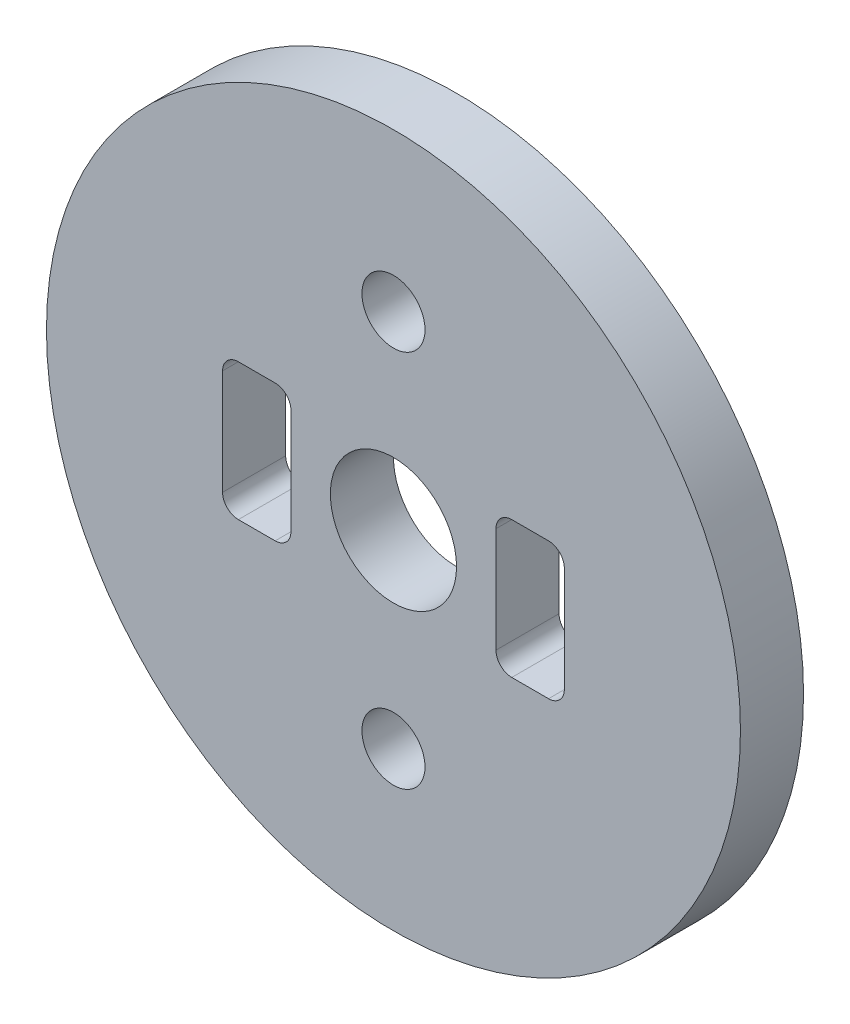
from build123d import *

# Parameters (mm, degrees)
MODEL_R                 = 16.5
MODEL_R_2               = 3
MODEL_R_3               = 1.5
SALIENTE_EXTRUIR1_DEPTH = 3


with BuildPart() as part:
    # Model → Saliente-Extruir1 (new body)
    with BuildSketch(Plane.XY):
        with Locations((215.747807914, 241.952019993)):
            Circle(MODEL_R)
        with Locations((215.747807914, 241.952019993)):
            Circle(MODEL_R_2, mode=Mode.SUBTRACT)
        with Locations((215.747807914, 250.952019993)):
            Circle(MODEL_R_3, mode=Mode.SUBTRACT)
        with Locations((215.747807914, 232.952019993)):
            Circle(MODEL_R_3, mode=Mode.SUBTRACT)
        with BuildLine():
            Line((223.122807913, 245.202019993), (221.372807913, 245.202019993))
            ThreePointArc((221.372807913, 245.202019993), (220.842477828, 244.982350079), (220.622807913, 244.452019993))
            Line((220.622807913, 244.452019993), (220.622807913, 239.452019993))
            ThreePointArc((220.622807913, 239.452019993), (220.842477828, 238.921689907), (221.372807913, 238.702019993))
            Line((221.372807913, 238.702019993), (223.122807913, 238.702019993))
            ThreePointArc((223.122807913, 238.702019993), (223.653137999, 238.921689907), (223.872807913, 239.452019993))
            Line((223.872807913, 239.452019993), (223.872807913, 244.452019993))
            ThreePointArc((223.872807913, 244.452019993), (223.653137999, 244.982350079), (223.122807913, 245.202019993))
        make_face(mode=Mode.SUBTRACT)
        with BuildLine():
            Line((208.372807913, 245.202019993), (210.122807913, 245.202019993))
            ThreePointArc((210.122807913, 245.202019993), (210.653137999, 244.982350079), (210.872807913, 244.452019993))
            Line((210.872807913, 244.452019993), (210.872807913, 239.452019993))
            ThreePointArc((210.872807913, 239.452019993), (210.653137999, 238.921689907), (210.122807913, 238.702019993))
            Line((210.122807913, 238.702019993), (208.372807913, 238.702019993))
            ThreePointArc((208.372807913, 238.702019993), (207.842477828, 238.921689907), (207.622807913, 239.452019993))
            Line((207.622807913, 239.452019993), (207.622807913, 244.452019993))
            ThreePointArc((207.622807913, 244.452019993), (207.842477828, 244.982350079), (208.372807913, 245.202019993))
        make_face(mode=Mode.SUBTRACT)
    extrude(amount=SALIENTE_EXTRUIR1_DEPTH)


solid = part.part
